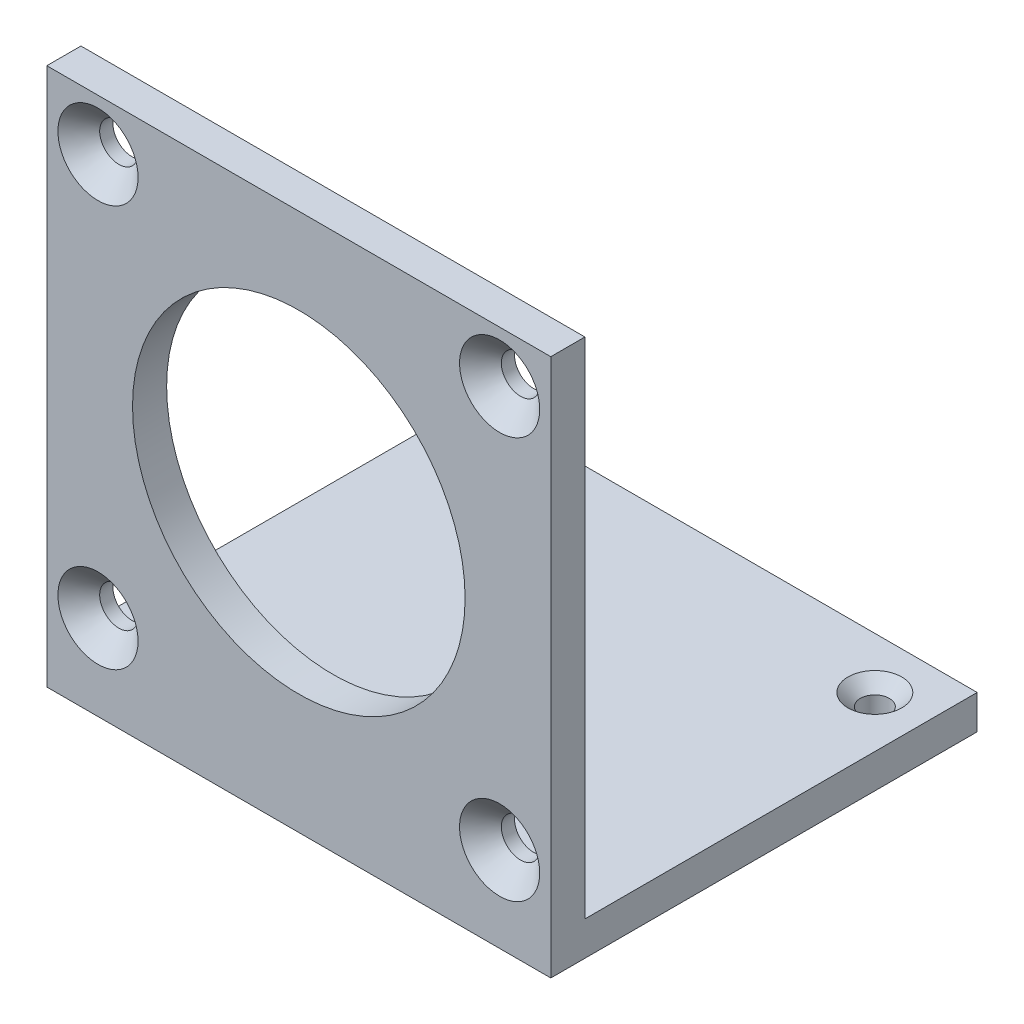
from build123d import *

# Parameters (mm, degrees)
SKETCH1_W                                       = 59.1
SKETCH1_H                                       = 59.1
SKETCH1_R                                       = 19.5
SKETCH1_R_2                                     = 1.55
BOSS_EXTRUDE1_DEPTH                             = 4
SKETCH2_W                                       = 59.1
SKETCH2_H                                       = 50
SKETCH2_R                                       = 1.5
BOSS_EXTRUDE2_DEPTH                             = 4
CSK_FOR_M3_FLAT_HEAD_MACHINE_SCREW1_D           = 3.4
CSK_FOR_M3_FLAT_HEAD_MACHINE_SCREW1_CSINK_D     = 6.3
CSK_FOR_M3_FLAT_HEAD_MACHINE_SCREW1_CSINK_ANGLE = 90
CSK_FOR_M4_FLAT_HEAD_MACHINE_SCREW1_D           = 4.5
CSK_FOR_M4_FLAT_HEAD_MACHINE_SCREW1_CSINK_D     = 9.4
CSK_FOR_M4_FLAT_HEAD_MACHINE_SCREW1_CSINK_ANGLE = 90


with BuildPart() as part:
    # Sketch1 → Boss-Extrude1 (new body)
    with BuildSketch(Plane.XY):
        with Locations((23.55, 23.55)):
            Rectangle(SKETCH1_W, SKETCH1_H)
        with Locations((23.55, 23.55)):
            Circle(SKETCH1_R, mode=Mode.SUBTRACT)
        with Locations((0, 47.1)):
            Circle(SKETCH1_R_2, mode=Mode.SUBTRACT)
        with Locations((47.1, 47.1)):
            Circle(SKETCH1_R_2, mode=Mode.SUBTRACT)
        with Locations((47.1, 0)):
            Circle(SKETCH1_R_2, mode=Mode.SUBTRACT)
        Circle(SKETCH1_R_2, mode=Mode.SUBTRACT)
    extrude(amount=BOSS_EXTRUDE1_DEPTH)

    # Sketch2 → Boss-Extrude2 (add)
    with BuildSketch(Plane.XZ.offset(6)):
        with Locations((23.55, -21)):
            Rectangle(SKETCH2_W, SKETCH2_H)
        with Locations(Location((0, -40, 0), (0, 0, 270))):
            Circle(SKETCH2_R, mode=Mode.SUBTRACT)
        with Locations(Location((47.1, -40, 0), (0, 0, 270))):
            Circle(SKETCH2_R, mode=Mode.SUBTRACT)
        with Locations(Location((23.55, -18, 0), (0, 0, 270))):
            Circle(SKETCH2_R, mode=Mode.SUBTRACT)
    extrude(amount=BOSS_EXTRUDE2_DEPTH)

    # CSK for M3 Flat Head Machine Screw1 (through all)
    with Locations(Plane(origin=(0, -6, 0), x_dir=(1, 0, 0), z_dir=(0, 1, 0))):
        with Locations((0, 40), (47.1, 40), (23.55, 18)):
            CounterSinkHole(CSK_FOR_M3_FLAT_HEAD_MACHINE_SCREW1_D / 2, CSK_FOR_M3_FLAT_HEAD_MACHINE_SCREW1_CSINK_D / 2, counter_sink_angle=CSK_FOR_M3_FLAT_HEAD_MACHINE_SCREW1_CSINK_ANGLE)

    # CSK for M4 Flat Head Machine Screw1 (through all)
    with Locations(Plane.XY.offset(4)):
        with Locations((0, 47.1), (47.1, 47.1), (47.1, 0), (0, 0)):
            CounterSinkHole(CSK_FOR_M4_FLAT_HEAD_MACHINE_SCREW1_D / 2, CSK_FOR_M4_FLAT_HEAD_MACHINE_SCREW1_CSINK_D / 2, counter_sink_angle=CSK_FOR_M4_FLAT_HEAD_MACHINE_SCREW1_CSINK_ANGLE)


solid = part.part
